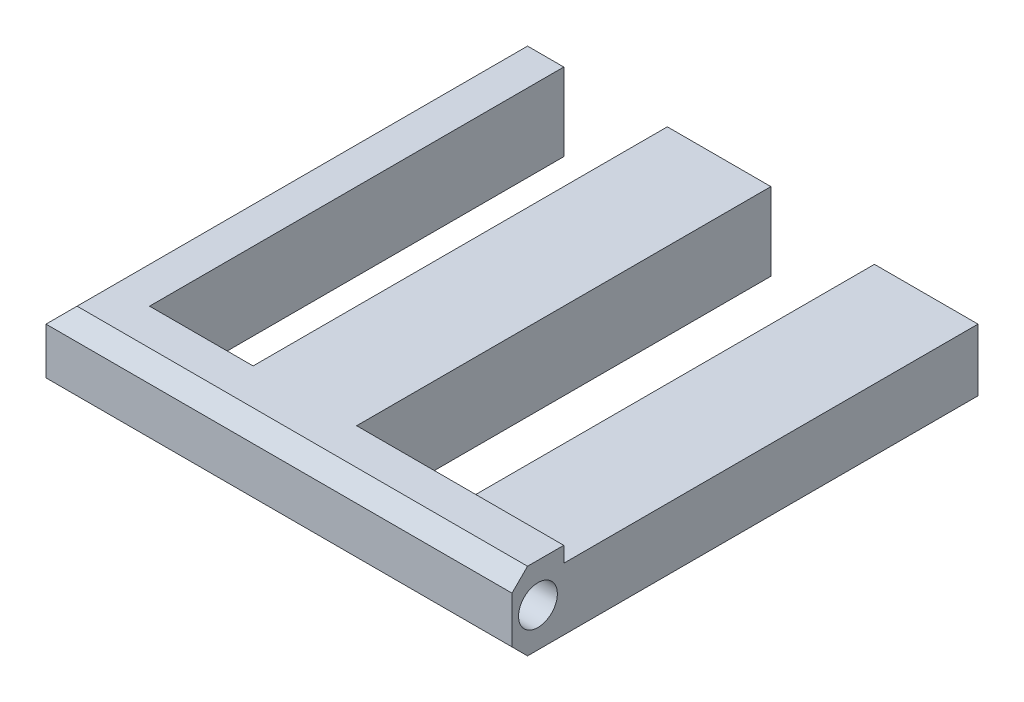
from build123d import *

# Parameters (mm, degrees)
SKETCH1_W           = 50.8
SKETCH1_H           = 203.2
BOSS_EXTRUDE2_DEPTH = 38.1
SKETCH2_R           = 9.525
CUT_EXTRUDE1_DEPTH  = 38.1
SKETCH3_R           = 9.525
CUT_EXTRUDE2_DEPTH  = 38.1
SKETCH4_W           = 254
SKETCH4_H           = 254.028971003
CUT_EXTRUDE3_DEPTH  = 7.62
CHAMFER1_SIZE       = 7.62


with BuildPart() as part:
    # Sketch1 → Boss-Extrude2 (new body)
    with BuildSketch(Plane(origin=(0, 0, 0), x_dir=(1, 0, 0), z_dir=(0, 1, 0))):
        Polygon((0, 0), (0, 25.4), (-50.8, 25.4), (-101.6, 25.4), (-152.4, 25.4), (-203.2, 25.4), (-203.2, 228.6), (-228.6, 228.6), (-228.6, 0), align=None)
        with Locations((-127, 127)):
            Rectangle(SKETCH1_W, SKETCH1_H)
        with Locations((-25.4, 127)):
            Rectangle(SKETCH1_W, SKETCH1_H)
    extrude(amount=BOSS_EXTRUDE2_DEPTH)

    # Sketch2 → Cut-Extrude1 (cut)
    with BuildSketch(Plane(origin=(0, 0, -228.6), x_dir=(-1, 0, 0), z_dir=(0, 0, -1))):
        with Locations((215.9, 19.05)):
            Circle(SKETCH2_R)
    extrude(amount=-CUT_EXTRUDE1_DEPTH, mode=Mode.SUBTRACT)

    # Sketch3 → Cut-Extrude2 (cut)
    with BuildSketch(Plane(origin=(0, 0, 0), x_dir=(0, 0, -1), z_dir=(1, 0, 0))):
        with Locations((12.728971003, 19.05)):
            Circle(SKETCH3_R)
    extrude(amount=-CUT_EXTRUDE2_DEPTH, mode=Mode.SUBTRACT)

    # Sketch4 → Cut-Extrude3 (cut)
    with BuildSketch(Plane(origin=(0, 38.1, 0), x_dir=(1, 0, 0), z_dir=(0, 1, 0))):
        with Locations((50.8, 152.414485501)):
            Rectangle(SKETCH4_W, SKETCH4_H)
    extrude(amount=-CUT_EXTRUDE3_DEPTH, mode=Mode.SUBTRACT)

    # Chamfer1
    chamfer1_edges = [part.edges().sort_by_distance(p)[0] for p in [
        (-114.3, 0, 0),
        (-228.6, 0, -114.3),
        (-228.6, 38.1, -114.3),
        (-114.3, 38.1, 0),
    ]]
    chamfer(chamfer1_edges, length=CHAMFER1_SIZE)


solid = part.part
